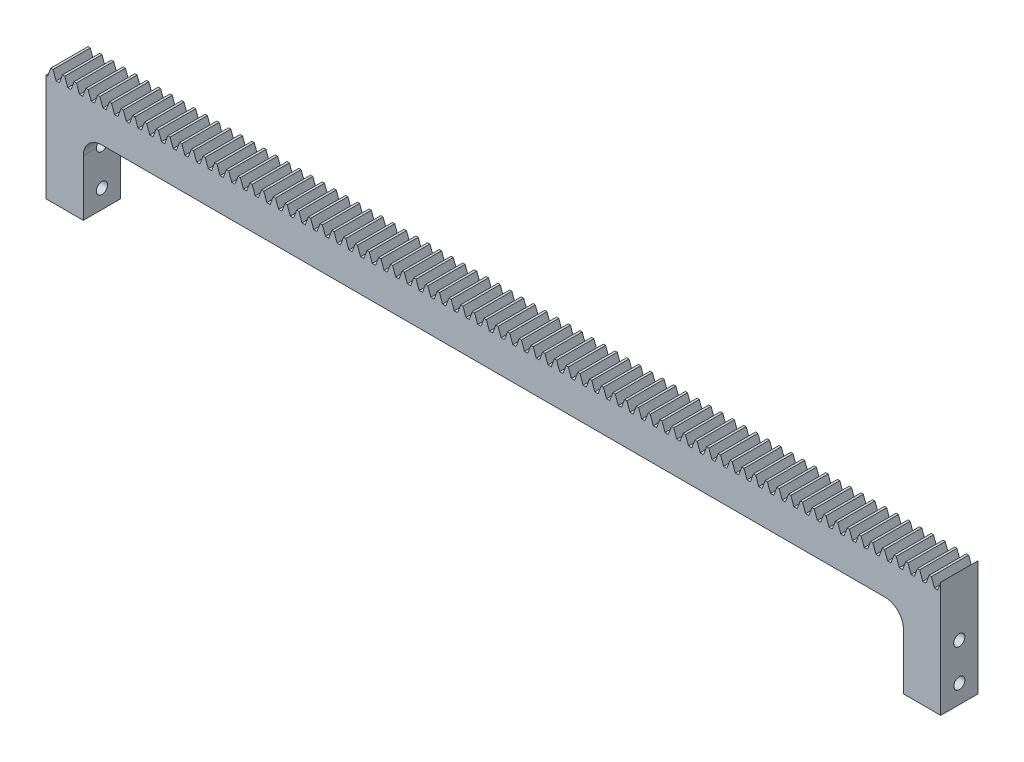
from build123d import *

# Parameters (mm, degrees)
BLANKSKE_W          = 240
BLANKSKE_H          = 11
BLANK_DEPTH         = 10
TOOTHCUTSIM_DEPTH   = 241.45997588
TEETHCUTS_COUNT     = 77
TEETHCUTS_PITCH     = 3.14159265
SKETCH1_W           = 10
SKETCH1_H           = 10
BOSS_EXTRUDE1_DEPTH = 20
FILLET1_R           = 5
SKETCH2_R           = 1.5
CUT_EXTRUDE1_DEPTH  = 242.039415864


with BuildPart() as part:
    # BlankSke → Blank (new body)
    with BuildSketch(Plane.XY):
        with Locations((120, 5.5)):
            Rectangle(BLANKSKE_W, BLANKSKE_H)
    extrude(amount=-BLANK_DEPTH)

    # TooCutSkeSim → ToothCutSim (cut, through all)
    with BuildSketch(Plane.XY):
        Polygon((0.44443537, 8.75), (-0.44443537, 8.75), (-1.272613241, 11.0254), (1.272613241, 11.0254), align=None)
    toothcutsim = extrude(amount=-TOOTHCUTSIM_DEPTH, mode=Mode.SUBTRACT)

    # TeethCuts: ToothCutSim ×77
    with Locations(*[(i * TEETHCUTS_PITCH, 0, 0) for i in range(1, TEETHCUTS_COUNT)]):
        add(toothcutsim, mode=Mode.SUBTRACT)

    # Sketch1 → Boss-Extrude1 (add)
    with BuildSketch(Plane(origin=(0, 0, 0), x_dir=(-1, 0, 0), z_dir=(0, -1, 0))):
        with Locations((-5, 5)):
            Rectangle(SKETCH1_W, SKETCH1_H)
        with Locations((-235, 5)):
            Rectangle(SKETCH1_W, SKETCH1_H)
    extrude(amount=BOSS_EXTRUDE1_DEPTH)

    # Fillet1
    fillet1_edges = [part.edges().sort_by_distance(p)[0] for p in [
        (10, 0, -5),
        (230, 0, -5),
    ]]
    fillet(fillet1_edges, radius=FILLET1_R)

    # Sketch2 → Cut-Extrude1 (cut, through all)
    with BuildSketch(Plane(origin=(240, 0, 0), x_dir=(0, 0, -1), z_dir=(1, 0, 0))):
        with Locations((5, -15)):
            Circle(SKETCH2_R)
        with Locations((4.978191042, -5.000023782)):
            Circle(SKETCH2_R)
    extrude(amount=-CUT_EXTRUDE1_DEPTH, mode=Mode.SUBTRACT)


solid = part.part
